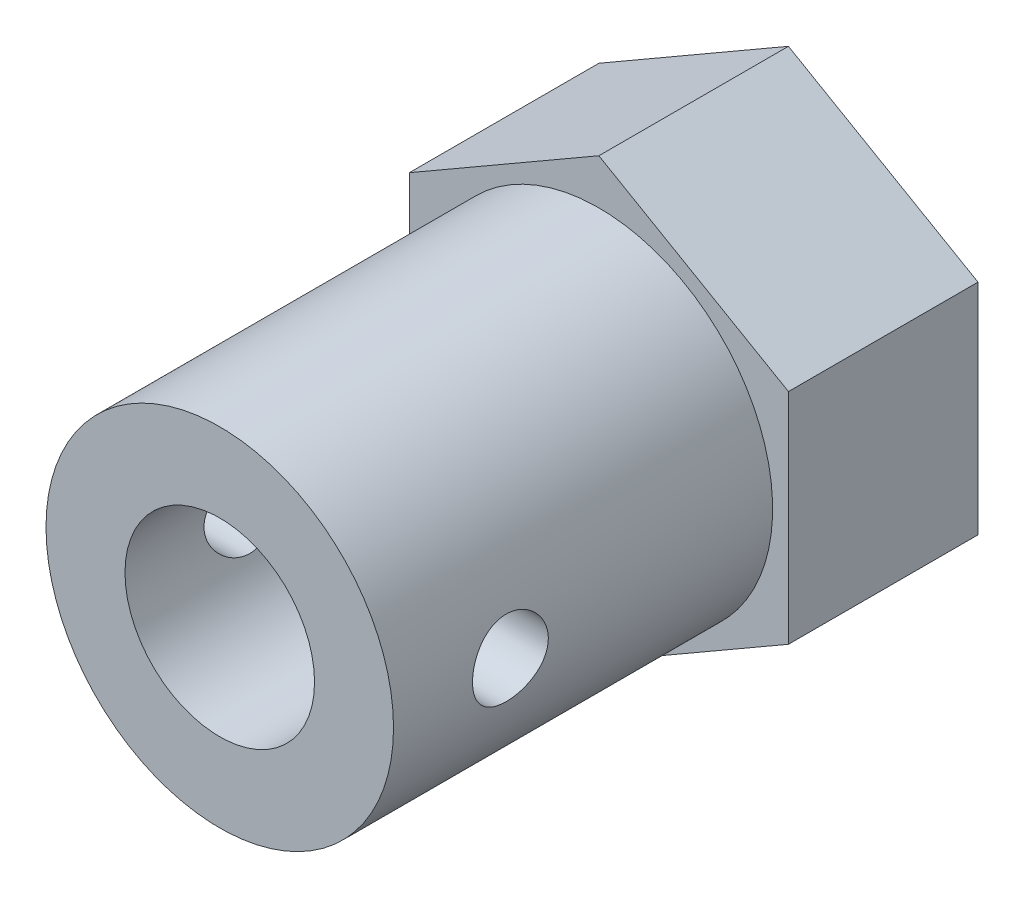
from build123d import *

# Parameters (mm, degrees)
ESQUISSE1_R                  = 5.5
BOSS_EXTRU_1_DEPTH           = 12
BOSS_EXTRU_2_DEPTH           = 6
ENL_V_MAT_EXTRU_1_DEPTH      = 16.099668871
ENL_V_MAT_EXTRU_1_DEPTH_BACK = 16.099668871
ESQUISSE3_R                  = 1.2
ESQUISSE4_R                  = 3
ENL_V_MAT_EXTRU_2_DEPTH      = 14
ESQUISSE5_R                  = 1.7
ENL_V_MAT_EXTRU_3_DEPTH      = 17.733200614


with BuildPart() as part:
    # Esquisse1 → Boss.-Extru.1 (new body)
    with BuildSketch(Plane.XY):
        Circle(ESQUISSE1_R)
    extrude(amount=BOSS_EXTRU_1_DEPTH)

    # Esquisse2 → Boss.-Extru.2 (add)
    with BuildSketch(Plane(origin=(0, 0, 0), x_dir=(-1, 0, 0), z_dir=(0, 0, -1))):
        Polygon((6, -3.464101615), (6, 3.464101615), (0, 6.92820323), (-6, 3.464101615), (-6, -3.464101615), (0, -6.92820323), align=None)
    extrude(amount=BOSS_EXTRU_2_DEPTH)

    # Esquisse3 → Enlèv. mat.-Extru.1 (cut, two sides: drawn at the far end of the back side and taken through both)
    with BuildSketch(Plane(origin=(0, 0, 0), x_dir=(0, 0, -1), z_dir=(1, 0, 0)).offset(-ENL_V_MAT_EXTRU_1_DEPTH_BACK)):
        with Locations((-8.3, 0)):
            Circle(ESQUISSE3_R)
    extrude(amount=ENL_V_MAT_EXTRU_1_DEPTH + ENL_V_MAT_EXTRU_1_DEPTH_BACK, mode=Mode.SUBTRACT)

    # Esquisse4 → Enlèv. mat.-Extru.2 (cut)
    with BuildSketch(Plane.XY.offset(12)):
        Circle(ESQUISSE4_R)
    extrude(amount=-ENL_V_MAT_EXTRU_2_DEPTH, mode=Mode.SUBTRACT)

    # Esquisse5 → Enlèv. mat.-Extru.3 (cut, through all)
    with BuildSketch(Plane.XY.offset(-2)):
        Circle(ESQUISSE5_R)
    extrude(amount=-ENL_V_MAT_EXTRU_3_DEPTH, mode=Mode.SUBTRACT)


solid = part.part
